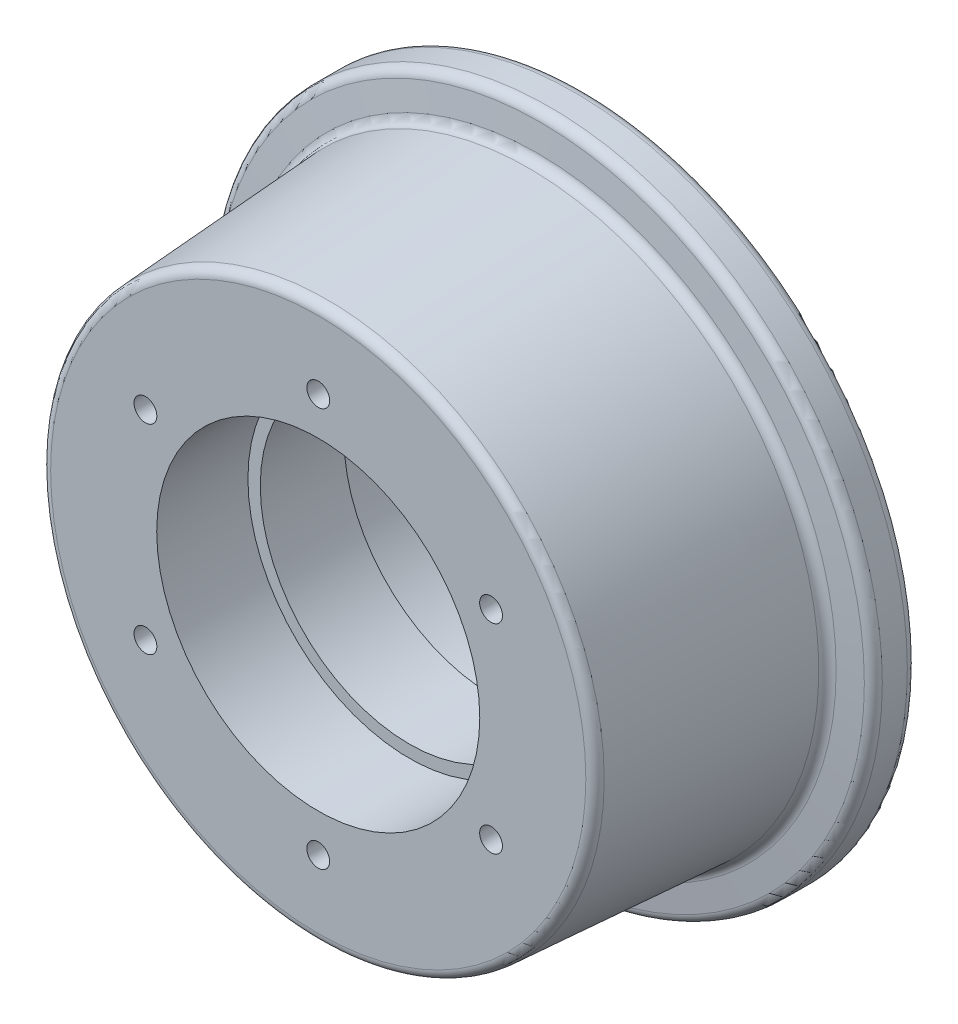
from build123d import *

# Parameters (mm, degrees)
FILLET_1_R               = 5
SKETCH_2_R               = 6
CUT_EXTRUDE_1_DEPTH      = 25
PATTERN_CIRCULAR_1_COUNT = 6
CUT_EXTRUDE_START        = -25
SKETCH_3_R               = 6
CUT_EXTRUDE_2_DEPTH      = 25
PATTERN_CIRCULAR_2_COUNT = 6


with BuildPart() as part:
    # 草图1 → 旋转1 (revolve)
    with BuildSketch(Plane(origin=(0, 0, 0), x_dir=(0, 0, -1), z_dir=(1, 0, 0)), mode=Mode.PRIVATE) as revolve_1_sk:
        Polygon((-22, 78.5), (22, 78.5), (22, 85), (75, 85), (75, 140), (70, 140), (70, 175), (47.323554344, 175), (45, 152.892857143), (-70, 145.5), (-70, 85), (-22, 85), align=None)
    revolve(revolve_1_sk.sketch.rotate(Axis((0, 0, 1000), (0, 0, -1)), 90), axis=Axis((0, 0, 1000), (0, 0, -1)))

    # 圆角1
    fillet_1_edges = [part.edges().sort_by_distance(p)[0] for p in [
        (-175, 0, -47.323554344),
        (-175, 0, -70),
        (-145.5, 0, 70),
        (-152.892857143, 0, -45),
    ]]
    fillet(fillet_1_edges, radius=FILLET_1_R)

    # 草图2 → 切除-拉伸1 (cut)
    with BuildSketch(Plane(origin=(0, 0, -75), x_dir=(-1, 0, 0), z_dir=(0, 0, -1))):
        with Locations((0, 105)):
            Circle(SKETCH_2_R)
    cut_extrude_1 = extrude(amount=-CUT_EXTRUDE_1_DEPTH, mode=Mode.SUBTRACT)

    # 阵列(圆周)1: 切除-拉伸1 ×6 about axis
    pattern_circular_1_axis = Axis((0, 0, 0), (0, 0, 1))
    for i in range(1, PATTERN_CIRCULAR_1_COUNT):
        add(cut_extrude_1.rotate(pattern_circular_1_axis, i * 360 / PATTERN_CIRCULAR_1_COUNT), mode=Mode.SUBTRACT)

    # 草图3 → 切除-拉伸2 (cut)
    with BuildSketch(Plane.XY.offset(70).offset(CUT_EXTRUDE_START)):
        with Locations(Location((0, 105, 0), (0, 0, 180))):
            Circle(SKETCH_3_R)
    cut_extrude_2 = extrude(amount=CUT_EXTRUDE_2_DEPTH, mode=Mode.SUBTRACT)

    # 阵列(圆周)2: 切除-拉伸2 ×6 about axis
    pattern_circular_2_axis = Axis((0, 0, 0), (0, 0, 1))
    for i in range(1, PATTERN_CIRCULAR_2_COUNT):
        add(cut_extrude_2.rotate(pattern_circular_2_axis, i * 360 / PATTERN_CIRCULAR_2_COUNT), mode=Mode.SUBTRACT)


solid = part.part
